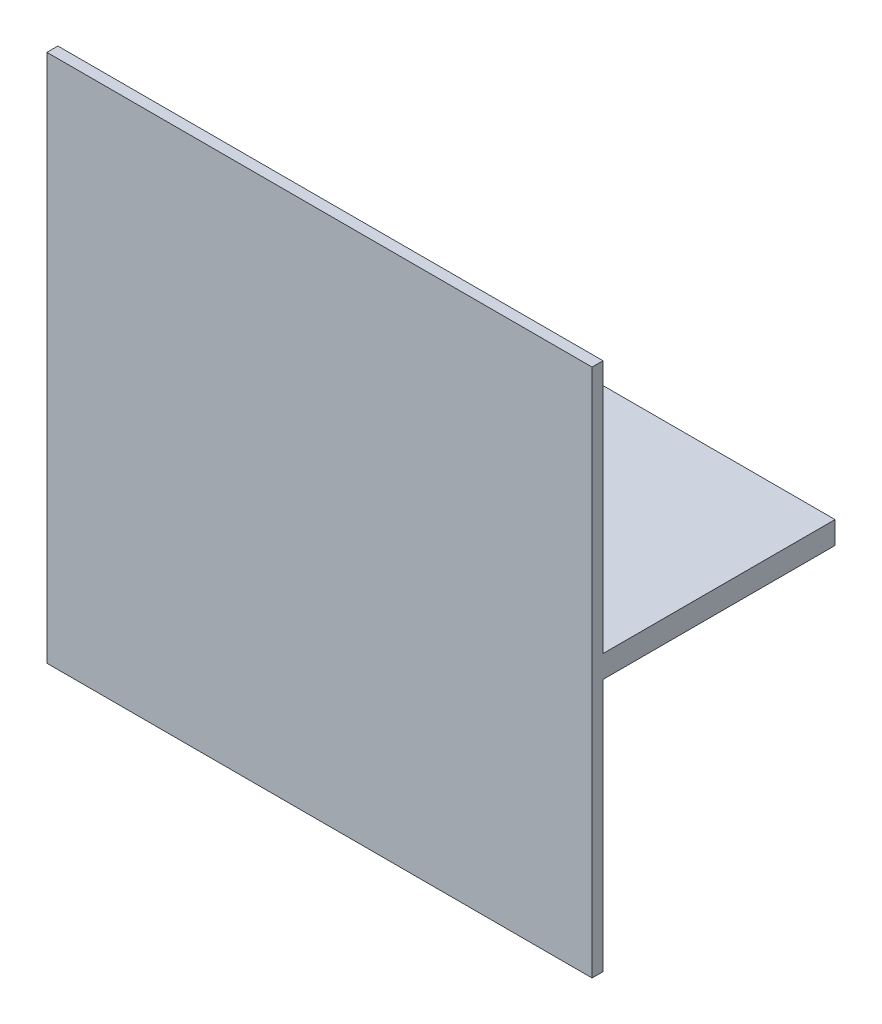
from build123d import *

# Parameters (mm, degrees)
SKETCH2_W           = 248.62
SKETCH2_H           = 5
BOSS_EXTRUDE1_DEPTH = 241.3
SKETCH3_W           = 248.62
SKETCH3_H           = 10.237657085
SKETCH3_W_2         = 228.62
SKETCH3_H_2         = 3.237657085
BOSS_EXTRUDE2_DEPTH = 105.84


with BuildPart() as part:
    # Sketch2 → Boss-Extrude1 (new body)
    with BuildSketch(Plane(origin=(0, 0, 0), x_dir=(1, 0, 0), z_dir=(0, 1, 0))):
        with Locations((-977.298943089, 163.246666667)):
            Rectangle(SKETCH2_W, SKETCH2_H)
    extrude(amount=BOSS_EXTRUDE1_DEPTH)

    # Sketch3 → Boss-Extrude2 (add)
    with BuildSketch(Plane(origin=(0, 0, -165.746666667), x_dir=(-1, 0, 0), z_dir=(0, 0, -1))):
        with Locations((977.298943089, 120.531171458)):
            Rectangle(SKETCH3_W, SKETCH3_H)
        with Locations((977.298943089, 120.531171458)):
            Rectangle(SKETCH3_W_2, SKETCH3_H_2, mode=Mode.SUBTRACT)
    extrude(amount=BOSS_EXTRUDE2_DEPTH)


solid = part.part
